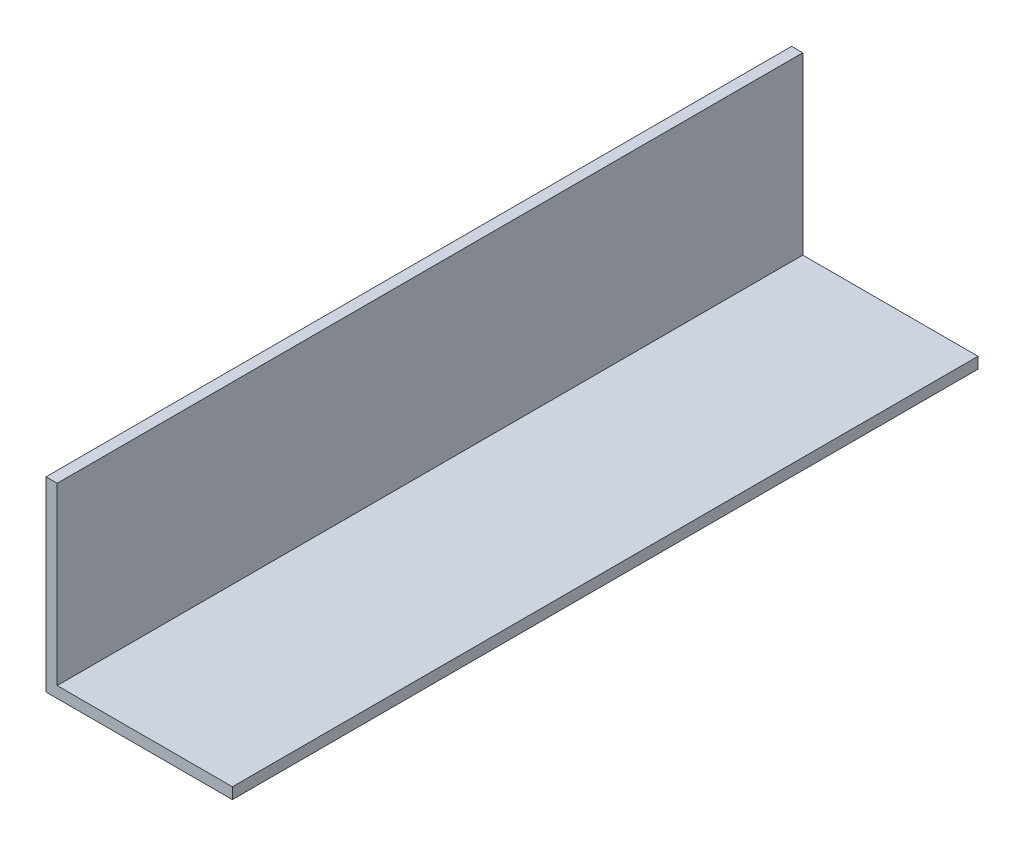
from build123d import *

# Parameters (mm, degrees)
BOSS_EXTRUDE1_DEPTH = 100


with BuildPart() as part:
    # Sketch1 → Boss-Extrude1 (new body)
    with BuildSketch(Plane.XY):
        Polygon((0, 0), (0, 25), (1.5, 25), (1.5, 1.5), (25, 1.5), (25, 0), align=None)
    extrude(amount=BOSS_EXTRUDE1_DEPTH)


solid = part.part
